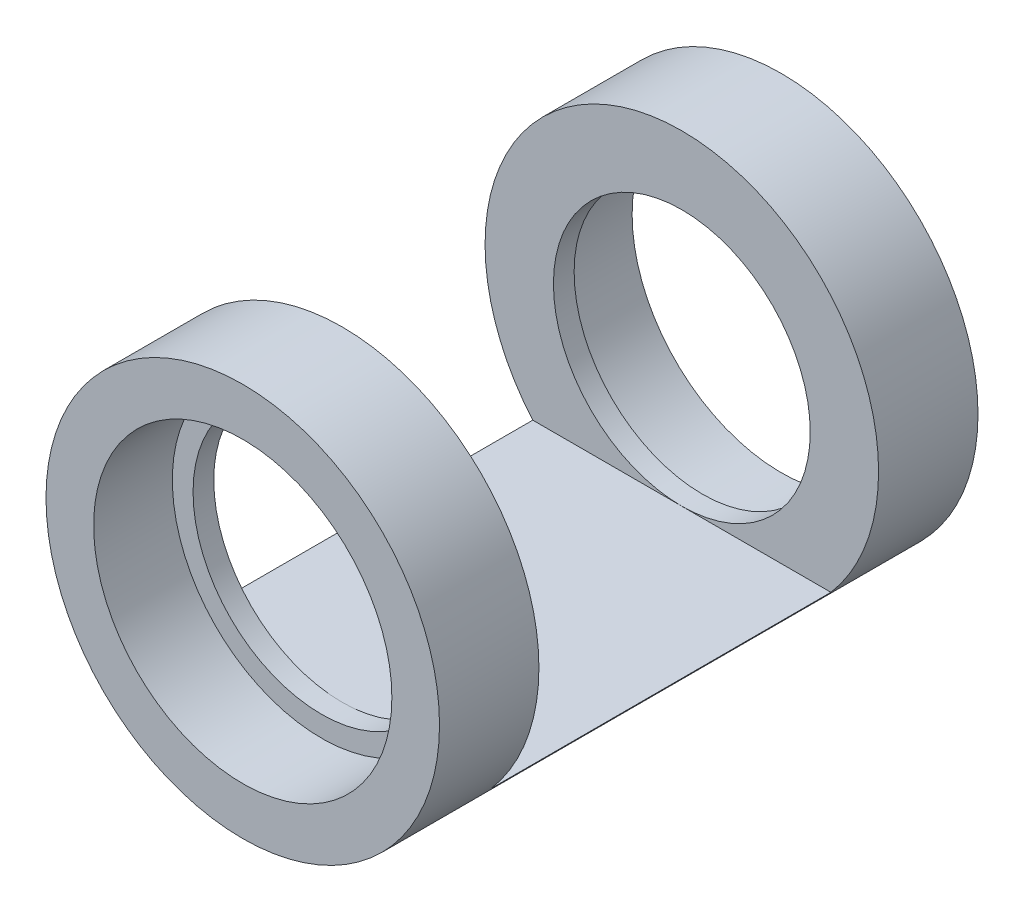
from build123d import *

# Parameters (mm, degrees)
SKETCH_1_R          = 47.5
EXTRUDE_1_DEPTH     = 65
CUT_EXTRUDE_1_DEPTH = 41
SKETCH_3_R          = 36
CUT_EXTRUDE_2_DEPTH = 19
SKETCH_4_R          = 31
CUT_EXTRUDE_3_DEPTH = 130.743978666
CUT_EXTRUDE_START   = -19
SKETCH_5_R          = 36
CUT_EXTRUDE_4_DEPTH = 19


with BuildPart() as part:
    # 草图1 → 凸台-拉伸1 (new, symmetric)
    with BuildSketch(Plane.XY):
        Circle(SKETCH_1_R)
    extrude(amount=EXTRUDE_1_DEPTH, both=True)

    # 草图2 → 切除-拉伸1 (cut, symmetric)
    with BuildSketch(Plane.XY):
        with BuildLine():
            Line((-35.989581826, -31), (35.989581826, -31))
            ThreePointArc((35.989581826, -31), (0, 47.5), (-35.989581826, -31))
        make_face()
    extrude(amount=CUT_EXTRUDE_1_DEPTH, both=True, mode=Mode.SUBTRACT)

    # 草图3 → 切除-拉伸2 (cut)
    with BuildSketch(Plane(origin=(0, 0, -65), x_dir=(-1, 0, 0), z_dir=(0, 0, -1))):
        Circle(SKETCH_3_R)
    extrude(amount=-CUT_EXTRUDE_2_DEPTH, mode=Mode.SUBTRACT)

    # 草图4 → 切除-拉伸3 (cut, through all)
    with BuildSketch(Plane(origin=(0, 0, -46), x_dir=(-1, 0, 0), z_dir=(0, 0, -1))):
        Circle(SKETCH_4_R)
    extrude(amount=-CUT_EXTRUDE_3_DEPTH, mode=Mode.SUBTRACT)

    # 草图5 → 切除-拉伸4 (cut)
    with BuildSketch(Plane.XY.offset(65).offset(CUT_EXTRUDE_START)):
        with Locations(Location((0, 0, 0), (0, 0, 180))):
            Circle(SKETCH_5_R)
    extrude(amount=CUT_EXTRUDE_4_DEPTH, mode=Mode.SUBTRACT)


solid = part.part
